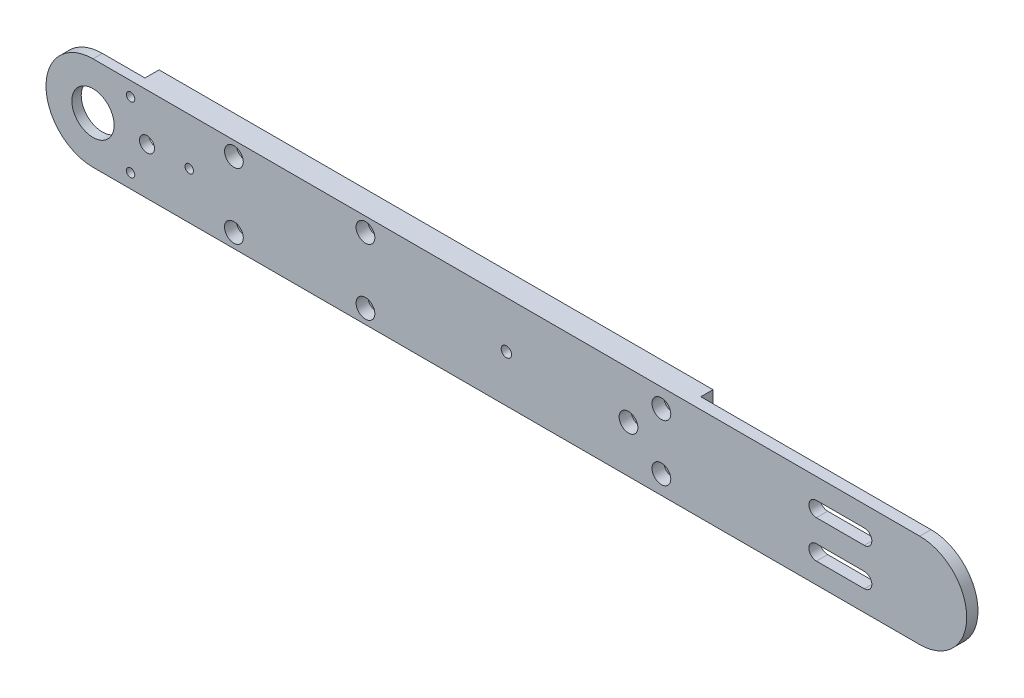
from build123d import *

# Parameters (mm, degrees)
EXTRUDE_1_DEPTH      = 5
SKETCH_1_3_R         = 1.1
CUT_EXTRUDE_2_DEPTH  = 187.33571853
SKETCH_1_4_R         = 2.55
CUT_EXTRUDE_3_DEPTH  = 2.6
SKETCH_2_R           = 1.25
CUT_EXTRUDE_4_DEPTH  = 187.33571853
CUT_EXTRUDE_START    = -5
SKETCH_2_3_R         = 2
CUT_EXTRUDE_5_DEPTH  = 2.5
SKETCH_3_W           = 59
SKETCH_3_H           = 2.6
CUT_EXTRUDE_6_DEPTH  = 188.138985783
CUT_EXTRUDE_7_DEPTH  = 187.33571853
SKETCH_5_W           = 210.843247287
SKETCH_5_H           = 25.236064347
CUT_EXTRUDE_8_DEPTH  = 187.33571853
SKETCH_6_R           = 13.5
CUT_EXTRUDE_9_DEPTH  = 3
SKETCH_7_R           = 4.5
CUT_EXTRUDE_10_DEPTH = 187.33571853
SKETCH_8_R           = 1.6
SKETCH_8_R_2         = 0.9
CUT_EXTRUDE_11_DEPTH = 187.33571853
SKETCH_9_W           = 303.789300412
SKETCH_9_H           = 109.247736626
CUT_EXTRUDE_12_DEPTH = 187.871613682


with BuildPart() as part:
    # 草图1 → 凸台-拉伸1 (new body)
    with BuildSketch(Plane.XY):
        with BuildLine():
            Line((0, -10), (176, -10))
            ThreePointArc((176, -10), (186, 0), (176, 10))
            Line((176, 10), (0, 10))
            ThreePointArc((0, 10), (-10, 0), (0, -10))
        make_face()
    extrude(amount=EXTRUDE_1_DEPTH)

    # 草图1<3> → 切除-拉伸2 (cut, through all)
    with BuildSketch(Plane.XY):
        with Locations((88, 0)):
            Circle(SKETCH_1_3_R)
        Circle(SKETCH_1_3_R)
    extrude(amount=CUT_EXTRUDE_2_DEPTH, mode=Mode.SUBTRACT)

    # 草图1<4> → 切除-拉伸3 (cut)
    with BuildSketch(Plane.XY):
        with Locations((88, 0)):
            Circle(SKETCH_1_4_R)
        Circle(SKETCH_1_4_R)
    extrude(amount=CUT_EXTRUDE_3_DEPTH, mode=Mode.SUBTRACT)

    # 草图2 → 切除-拉伸4 (cut, through all)
    with BuildSketch(Plane(origin=(0, 0, 0), x_dir=(-1, 0, 0), z_dir=(0, 0, -1))):
        with Locations((-121, -6)):
            Circle(SKETCH_2_R)
        with Locations((-121, 6)):
            Circle(SKETCH_2_R)
        with Locations((-114, 0)):
            Circle(SKETCH_2_R)
        with Locations((-58, 7)):
            Circle(SKETCH_2_R)
        with Locations((-30, 7)):
            Circle(SKETCH_2_R)
        with Locations((-58, -7)):
            Circle(SKETCH_2_R)
        with Locations((-30, -7)):
            Circle(SKETCH_2_R)
    extrude(amount=-CUT_EXTRUDE_4_DEPTH, mode=Mode.SUBTRACT)

    # 草图2<3> → 切除-拉伸5 (cut)
    with BuildSketch(Plane(origin=(0, 0, 0), x_dir=(-1, 0, 0), z_dir=(0, 0, -1)).offset(CUT_EXTRUDE_START)):
        with Locations(Location((-121, -6, 0), (0, 0, 180))):
            Circle(SKETCH_2_3_R)
        with Locations(Location((-121, 6, 0), (0, 0, 180))):
            Circle(SKETCH_2_3_R)
        with Locations(Location((-114, 0, 0), (0, 0, 180))):
            Circle(SKETCH_2_3_R)
        with Locations(Location((-58, 7, 0), (0, 0, 180))):
            Circle(SKETCH_2_3_R)
        with Locations(Location((-30, 7, 0), (0, 0, 180))):
            Circle(SKETCH_2_3_R)
        with Locations(Location((-58, -7, 0), (0, 0, 180))):
            Circle(SKETCH_2_3_R)
        with Locations(Location((-30, -7, 0), (0, 0, 180))):
            Circle(SKETCH_2_3_R)
    extrude(amount=CUT_EXTRUDE_5_DEPTH, mode=Mode.SUBTRACT)

    # 草图3 → 切除-拉伸6 (cut, through all)
    with BuildSketch(Plane(origin=(0, 10, 0), x_dir=(1, 0, 0), z_dir=(0, 1, 0))):
        with Locations((156.5, -1.3)):
            Rectangle(SKETCH_3_W, SKETCH_3_H)
    extrude(amount=-CUT_EXTRUDE_6_DEPTH, mode=Mode.SUBTRACT)

    # 草图4 → 切除-拉伸7 (cut, through all)
    with BuildSketch(Plane.XY.offset(5)):
        with BuildLine():
            Line((164.2, -2.4), (154, -2.4))
            ThreePointArc((154, -2.4), (152.4, -4), (154, -5.6))
            Line((154, -5.6), (164.2, -5.6))
            ThreePointArc((164.2, -5.6), (165.8, -4), (164.2, -2.4))
        make_face()
        with BuildLine():
            ThreePointArc((154, 5.6), (152.4, 4), (154, 2.4))
            Line((154, 2.4), (164.2, 2.4))
            ThreePointArc((164.2, 2.4), (165.8, 4), (164.2, 5.6))
            Line((164.2, 5.6), (154, 5.6))
        make_face()
    extrude(amount=-CUT_EXTRUDE_7_DEPTH, mode=Mode.SUBTRACT)

    # 镜向1: part across plane


with BuildPart() as part_1:
    add(part.part)
    add(part.part.mirror(Plane.XY))

    # 草图5 → 切除-拉伸8 (cut, through all)
    with BuildSketch(Plane.XY):
        with Locations((85.761316873, -1.017583239)):
            Rectangle(SKETCH_5_W, SKETCH_5_H)
    extrude(amount=CUT_EXTRUDE_8_DEPTH, mode=Mode.SUBTRACT)

    # 草图6 → 切除-拉伸9 (cut)
    with BuildSketch(Plane.XY):
        Circle(SKETCH_6_R)
    extrude(amount=-CUT_EXTRUDE_9_DEPTH, mode=Mode.SUBTRACT)

    # 草图7 → 切除-拉伸10 (cut, through all)
    with BuildSketch(Plane(origin=(0, 0, -5), x_dir=(-1, 0, 0), z_dir=(0, 0, -1))):
        Circle(SKETCH_7_R)
    extrude(amount=-CUT_EXTRUDE_10_DEPTH, mode=Mode.SUBTRACT)

    # 草图8 → 切除-拉伸11 (cut, through all)
    with BuildSketch(Plane(origin=(0, 0, -5), x_dir=(-1, 0, 0), z_dir=(0, 0, -1))):
        with Locations((-11.5, 0)):
            Circle(SKETCH_8_R)
        with Locations((-8, 7)):
            Circle(SKETCH_8_R_2)
        with Locations((-8, -7)):
            Circle(SKETCH_8_R_2)
        with Locations((-20.5, 0)):
            Circle(SKETCH_8_R_2)
    extrude(amount=-CUT_EXTRUDE_11_DEPTH, mode=Mode.SUBTRACT)


with BuildPart() as body_2:
    # 镜向2: mirrored copy
    add(part_1.part.mirror(Plane(origin=(0, 0, -15), x_dir=(1, 0, 0), z_dir=(0, 0, -1))))


with BuildPart() as part_2:
    add(part_1.part)

    # 草图9 → 切除-拉伸12 (cut, through all)
    with BuildSketch(Plane(origin=(0, 0, -15), x_dir=(-1, 0, 0), z_dir=(0, 0, -1))):
        with Locations((-102.439506173, 7.387654321)):
            Rectangle(SKETCH_9_W, SKETCH_9_H)
    extrude(amount=-CUT_EXTRUDE_12_DEPTH, mode=Mode.SUBTRACT)


solid = body_2.part
